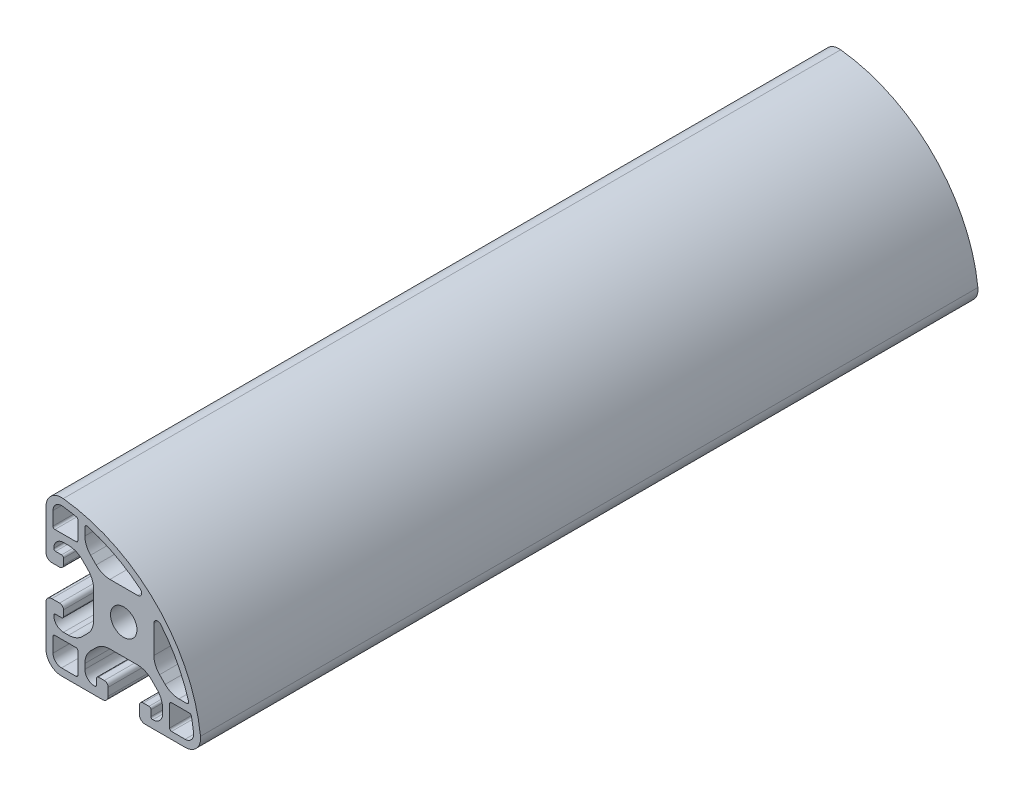
from build123d import *

# Parameters (mm, degrees)
SCHIZZO1_R                   = 3.4
ESTRUSIONE_ESTRUSIONE1_DEPTH = 200


with BuildPart() as part:
    # Schizzo1 → Estrusione-Estrusione1 (new body)
    with BuildSketch(Plane(origin=(0, 0, -1034), x_dir=(-1, 0, 0), z_dir=(0, 0, -1))):
        with BuildLine():
            Line((-16, 3.5), (-16, 1.5))
            ThreePointArc((-16, 1.5), (-15.560660172, 0.439339828), (-14.5, 0))
            Line((-14.5, 0), (-4, 0))
            ThreePointArc((-4, 0), (-1.171572875, 1.171572875), (0, 4))
            Line((0, 4), (0, 14.5))
            ThreePointArc((0, 14.5), (-0.439339828, 15.560660172), (-1.5, 16))
            Line((-1.5, 16), (-3.5, 16))
            ThreePointArc((-3.5, 16), (-4.207106781, 15.707106781), (-4.5, 15))
            Line((-4.5, 15), (-4.5, 13.5))
            ThreePointArc((-4.5, 13.5), (-4.353553391, 13.146446609), (-4, 13))
            Line((-4, 13), (-2.45, 13))
            ThreePointArc((-2.45, 13), (-2.131801948, 12.868198052), (-2, 12.55))
            Line((-2, 12.55), (-2, 12.5))
            ThreePointArc((-2, 12.5), (-2.732233047, 10.732233047), (-4.5, 10))
            Line((-4.5, 10), (-5.807611845, 10))
            ThreePointArc((-5.807611845, 10), (-7.721029007, 10.380602337), (-9.343145751, 11.464466094))
            Line((-9.343145751, 11.464466094), (-10.785533906, 12.906854249))
            ThreePointArc((-10.785533906, 12.906854249), (-11.869397663, 14.528970994), (-12.25, 16.442388155))
            Line((-12.25, 16.442388155), (-12.25, 23.557611845))
            ThreePointArc((-12.25, 23.557611845), (-11.869397663, 25.471029006), (-10.785533906, 27.09314575))
            Line((-10.785533906, 27.09314575), (-9.343145751, 28.535533906))
            ThreePointArc((-9.343145751, 28.535533906), (-7.721029006, 29.619397663), (-5.807611845, 30))
            Line((-5.807611845, 30), (-4.5, 30))
            ThreePointArc((-4.5, 30), (-2.732233047, 29.267766953), (-2, 27.5))
            Line((-2, 27.5), (-2, 27.45))
            ThreePointArc((-2, 27.45), (-2.131801948, 27.131801948), (-2.45, 27))
            Line((-2.45, 27), (-4, 27))
            ThreePointArc((-4, 27), (-4.353553391, 26.853553391), (-4.5, 26.5))
            Line((-4.5, 26.5), (-4.5, 25))
            ThreePointArc((-4.5, 25), (-4.207106781, 24.292893219), (-3.5, 24))
            Line((-3.5, 24), (-1.5, 24))
            ThreePointArc((-1.5, 24), (-0.439339828, 24.439339828), (0, 25.5))
            Line((0, 25.5), (0, 35.77708764))
            ThreePointArc((0, 35.77708764), (-1.333333333, 38.75851161), (-4.444444444, 39.7523196))
            ThreePointArc((-4.444444444, 39.7523196), (-28.284271247, 28.284271247), (-39.7523196, 4.444444444))
            ThreePointArc((-39.7523196, 4.444444444), (-38.75851161, 1.333333333), (-35.77708764, 0))
            Line((-35.77708764, 0), (-25.5, 0))
            ThreePointArc((-25.5, 0), (-24.439339828, 0.439339828), (-24, 1.5))
            Line((-24, 1.5), (-24, 3.5))
            ThreePointArc((-24, 3.5), (-24.292893219, 4.207106781), (-25, 4.5))
            Line((-25, 4.5), (-26.5, 4.5))
            ThreePointArc((-26.5, 4.5), (-26.853553391, 4.353553391), (-27, 4))
            Line((-27, 4), (-27, 2.45))
            ThreePointArc((-27, 2.45), (-27.131801948, 2.131801948), (-27.45, 2))
            Line((-27.45, 2), (-27.5, 2))
            ThreePointArc((-27.5, 2), (-29.267766953, 2.732233047), (-30, 4.5))
            Line((-30, 4.5), (-30, 5.807611845))
            ThreePointArc((-30, 5.807611845), (-29.619397663, 7.721029006), (-28.535533906, 9.343145751))
            Line((-28.535533906, 9.343145751), (-27.09314575, 10.785533906))
            ThreePointArc((-27.09314575, 10.785533906), (-25.471029006, 11.869397663), (-23.557611845, 12.25))
            Line((-23.557611845, 12.25), (-16.442388155, 12.25))
            ThreePointArc((-16.442388155, 12.25), (-14.528970994, 11.869397663), (-12.90685425, 10.785533906))
            Line((-12.90685425, 10.785533906), (-11.464466094, 9.343145751))
            ThreePointArc((-11.464466094, 9.343145751), (-10.380602337, 7.721029006), (-10, 5.807611845))
            Line((-10, 5.807611845), (-10, 4.5))
            ThreePointArc((-10, 4.5), (-10.732233047, 2.732233047), (-12.5, 2))
            Line((-12.5, 2), (-12.55, 2))
            ThreePointArc((-12.55, 2), (-12.868198052, 2.131801948), (-13, 2.45))
            Line((-13, 2.45), (-13, 4))
            ThreePointArc((-13, 4), (-13.146446609, 4.353553391), (-13.5, 4.5))
            Line((-13.5, 4.5), (-15, 4.5))
            ThreePointArc((-15, 4.5), (-15.707106781, 4.207106781), (-16, 3.5))
        make_face()
        with Locations(Location((-20, 20, 0), (0, 0, 180))):
            Circle(SCHIZZO1_R, mode=Mode.SUBTRACT)
        with BuildLine():
            Line((-8.2, 32.3), (-8.2, 36.905284174))
            ThreePointArc((-8.2, 36.905284174), (-8.087982608, 37.220672025), (-7.802122016, 37.394744177))
            ThreePointArc((-7.802122016, 37.394744177), (-6.029991855, 37.721071011), (-4.244444444, 37.963465218))
            ThreePointArc((-4.244444444, 37.963465218), (-2.533333333, 37.416870823), (-1.8, 35.77708764))
            Line((-1.8, 35.77708764), (-1.8, 32.3))
            ThreePointArc((-1.8, 32.3), (-1.946446609, 31.946446609), (-2.3, 31.8))
            Line((-2.3, 31.8), (-7.7, 31.8))
            ThreePointArc((-7.7, 31.8), (-8.053553391, 31.946446609), (-8.2, 32.3))
        make_face(mode=Mode.SUBTRACT)
        with BuildLine():
            Line((-4, 1.8), (-7.7, 1.8))
            ThreePointArc((-7.7, 1.8), (-8.053553391, 1.946446609), (-8.2, 2.3))
            Line((-8.2, 2.3), (-8.2, 7.7))
            ThreePointArc((-8.2, 7.7), (-8.053553391, 8.053553391), (-7.7, 8.2))
            Line((-7.7, 8.2), (-2.3, 8.2))
            ThreePointArc((-2.3, 8.2), (-1.946446609, 8.053553391), (-1.8, 7.7))
            Line((-1.8, 7.7), (-1.8, 4))
            ThreePointArc((-1.8, 4), (-2.444365081, 2.444365081), (-4, 1.8))
        make_face(mode=Mode.SUBTRACT)
        with BuildLine():
            Line((-27.75, 23.606725737), (-27.75, 16.442388155))
            ThreePointArc((-27.75, 16.442388155), (-28.130602337, 14.528970994), (-29.214466094, 12.906854249))
            Line((-29.214466094, 12.906854249), (-30.656854249, 11.464466094))
            ThreePointArc((-30.656854249, 11.464466094), (-32.278970994, 10.380602337), (-34.192388155, 10))
            Line((-34.192388155, 10), (-36.208286344, 10))
            ThreePointArc((-36.208286344, 10), (-36.608054182, 10.199690699), (-36.688502344, 10.639257294))
            ThreePointArc((-36.688502344, 10.639257294), (-33.797037909, 17.804500235), (-29.522849462, 24.241315138))
            ThreePointArc((-29.522849462, 24.241315138), (-28.412990699, 24.548227054), (-27.75, 23.606725737))
        make_face(mode=Mode.SUBTRACT)
        with BuildLine():
            Line((-10, 36.208286344), (-10, 34.192388155))
            ThreePointArc((-10, 34.192388155), (-10.380602337, 32.278970994), (-11.464466094, 30.656854249))
            Line((-11.464466094, 30.656854249), (-12.906854249, 29.214466094))
            ThreePointArc((-12.906854249, 29.214466094), (-14.528970994, 28.130602337), (-16.442388155, 27.75))
            Line((-16.442388155, 27.75), (-23.606725737, 27.75))
            ThreePointArc((-23.606725737, 27.75), (-24.548227054, 28.412990699), (-24.241315138, 29.522849462))
            ThreePointArc((-24.241315138, 29.522849462), (-17.804500235, 33.797037909), (-10.639257294, 36.688502344))
            ThreePointArc((-10.639257294, 36.688502344), (-10.199690699, 36.608054182), (-10, 36.208286344))
        make_face(mode=Mode.SUBTRACT)
        with BuildLine():
            Line((-36.905284174, 8.2), (-32.3, 8.2))
            ThreePointArc((-32.3, 8.2), (-31.946446609, 8.053553391), (-31.8, 7.7))
            Line((-31.8, 7.7), (-31.8, 2.3))
            ThreePointArc((-31.8, 2.3), (-31.946446609, 1.946446609), (-32.3, 1.8))
            Line((-32.3, 1.8), (-35.77708764, 1.8))
            ThreePointArc((-35.77708764, 1.8), (-37.416870823, 2.533333333), (-37.963465218, 4.244444444))
            ThreePointArc((-37.963465218, 4.244444444), (-37.721071011, 6.029991855), (-37.394744177, 7.802122016))
            ThreePointArc((-37.394744177, 7.802122016), (-37.220672025, 8.087982608), (-36.905284174, 8.2))
        make_face(mode=Mode.SUBTRACT)
    extrude(amount=-ESTRUSIONE_ESTRUSIONE1_DEPTH)


solid = part.part
